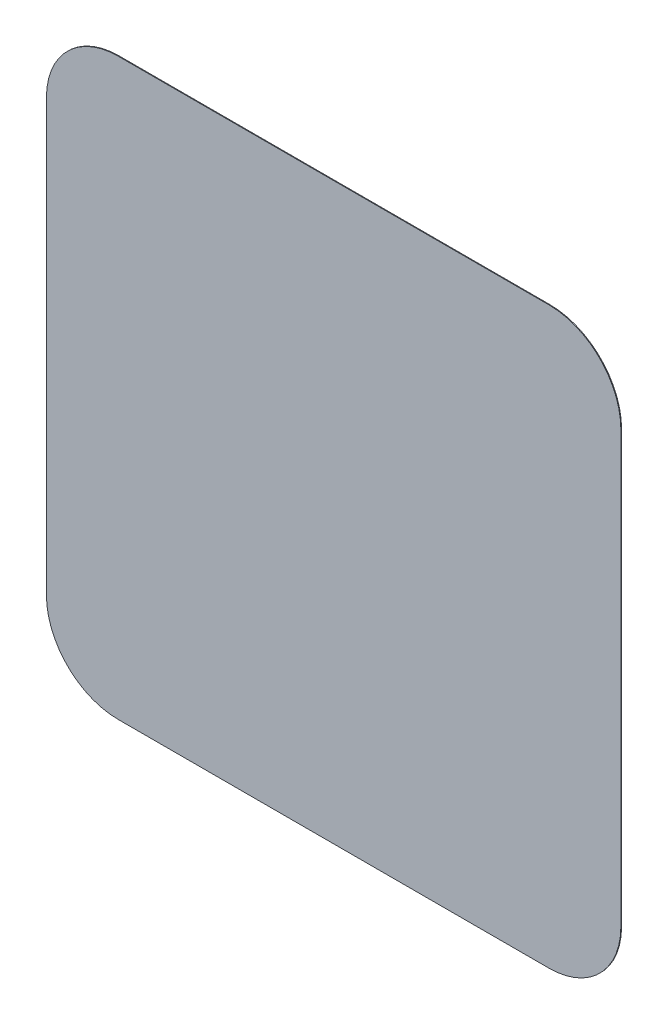
from build123d import *

# Parameters (mm, degrees)
SKETCH2_W          = 8
SKETCH2_H          = 8
BASE_EXTRUDE_DEPTH = 0.01
FILLET1_R          = 1


with BuildPart() as part:
    # Sketch2 → Base-Extrude (new body)
    with BuildSketch(Plane.XY):
        Rectangle(SKETCH2_W, SKETCH2_H)
    extrude(amount=BASE_EXTRUDE_DEPTH)

    # Fillet1
    fillet1_edges = [part.edges().sort_by_distance(p)[0] for p in [
        (-4, -4, 0.005),
        (4, -4, 0.005),
        (4, 4, 0.005),
        (-4, 4, 0.005),
    ]]
    fillet(fillet1_edges, radius=FILLET1_R)


solid = part.part
